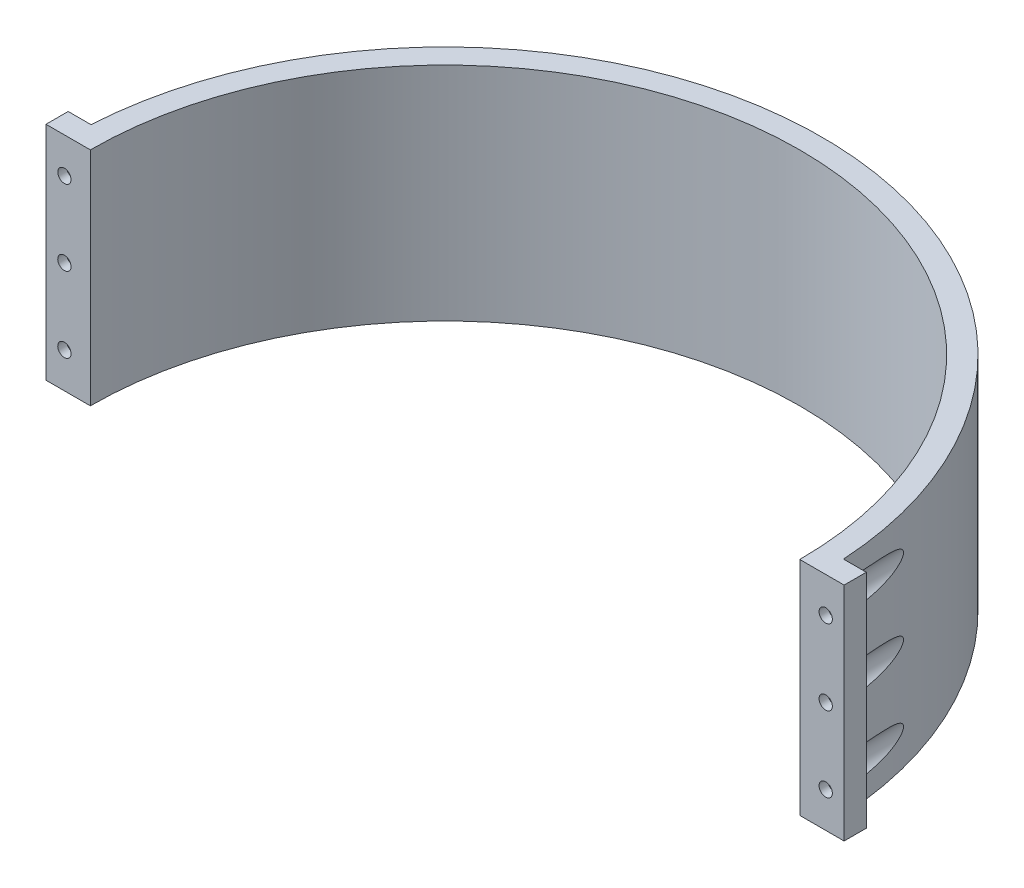
from build123d import *

# Parameters (mm, degrees)
BOSS_EXTRUDE1_DEPTH     = 50
SKETCH2_W               = 5
SKETCH2_H               = 50
BOSS_EXTRUDE2_DEPTH     = 5
BOSS_EXTRUDE2_2_DEPTH   = 5
SKETCH3_W               = 8.095126166
SKETCH3_H               = 5
BOSS_EXTRUDE3_DEPTH     = 50
CUT_EXTRUDE1_DEPTH      = 131.384048104
CUT_EXTRUDE1_DEPTH_BACK = 3
SKETCH4_R               = 3.5
SKETCH5_R               = 1.5
CUT_EXTRUDE2_DEPTH      = 133.245983026


with BuildPart() as part:
    # Sketch1 → Boss-Extrude1 (new body)
    with BuildSketch(Plane(origin=(0, 0, 0), x_dir=(1, 0, 0), z_dir=(0, 1, 0))):
        with BuildLine():
            Line((-85, 0), (-80, 0))
            ThreePointArc((-80, 0), (0, 80), (80, 0))
            Line((80, 0), (85, 0))
            ThreePointArc((85, 0), (0, 85), (-85, 0))
        make_face()
    extrude(amount=BOSS_EXTRUDE1_DEPTH)



with BuildPart() as body_2:
    # Sketch2 → Boss-Extrude2 (new body)
    with BuildSketch(Plane.XY):
        with Locations((87.5, 25)):
            Rectangle(SKETCH2_W, SKETCH2_H)
    extrude(amount=-BOSS_EXTRUDE2_DEPTH)


with BuildPart() as body_3:
    # Sketch2 → Boss-Extrude2 2 (new body)
    with BuildSketch(Plane.XY):
        with Locations((-87.5, 25)):
            Rectangle(SKETCH2_W, SKETCH2_H)
    extrude(amount=-BOSS_EXTRUDE2_2_DEPTH)


with BuildPart() as part_1:
    add(part.part)

    add(body_2.part)  # Boss-Extrude3 merges body 2

    add(body_3.part)  # Boss-Extrude3 merges body 3
    # Sketch3 → Boss-Extrude3 (add)
    with BuildSketch(Plane(origin=(0, 50, 0), x_dir=(1, 0, 0), z_dir=(0, 1, 0))):
        with Locations((-85.952436917, 2.5)):
            Rectangle(SKETCH3_W, SKETCH3_H)
        with Locations((85.952436917, 2.5)):
            Rectangle(SKETCH3_W, SKETCH3_H)
    extrude(amount=-BOSS_EXTRUDE3_DEPTH)

    # Sketch4 → Cut-Extrude1 (cut, two sides: drawn at the far end of the back side and taken through both)
    with BuildSketch(Plane(origin=(0, 0, -5), x_dir=(-1, 0, 0), z_dir=(0, 0, -1)).offset(-CUT_EXTRUDE1_DEPTH_BACK)):
        with Locations(Location((85.852813742, 42, 0), (0, 0, 253.398450401))):
            Circle(SKETCH4_R)
        with Locations(Location((85.852813742, 25, 0), (0, 0, 253.398450401))):
            Circle(SKETCH4_R)
        with Locations(Location((85.852813742, 8, 0), (0, 0, 253.398450401))):
            Circle(SKETCH4_R)
        with Locations(Location((-85.852813742, 8, 0), (0, 0, 180))):
            Circle(SKETCH4_R)
        with Locations(Location((-85.852813742, 25, 0), (0, 0, 180))):
            Circle(SKETCH4_R)
        with Locations(Location((-85.852813742, 42, 0), (0, 0, 180))):
            Circle(SKETCH4_R)
    extrude(amount=CUT_EXTRUDE1_DEPTH + CUT_EXTRUDE1_DEPTH_BACK, mode=Mode.SUBTRACT)

    # Sketch5 → Cut-Extrude2 (cut, through all)
    with BuildSketch(Plane(origin=(0, 0, -2), x_dir=(-1, 0, 0), z_dir=(0, 0, -1))):
        with Locations((85.852813742, 42)):
            Circle(SKETCH5_R)
        with Locations((85.852813742, 25)):
            Circle(SKETCH5_R)
        with Locations(Location((-85.852813742, 8, 0), (0, 0, 180))):
            Circle(SKETCH5_R)
        with Locations((85.852813742, 8)):
            Circle(SKETCH5_R)
        with Locations(Location((-85.852813742, 25, 0), (0, 0, 180))):
            Circle(SKETCH5_R)
        with Locations(Location((-85.852813742, 42, 0), (0, 0, 180))):
            Circle(SKETCH5_R)
    extrude(amount=-CUT_EXTRUDE2_DEPTH, mode=Mode.SUBTRACT)


solid = part_1.part
